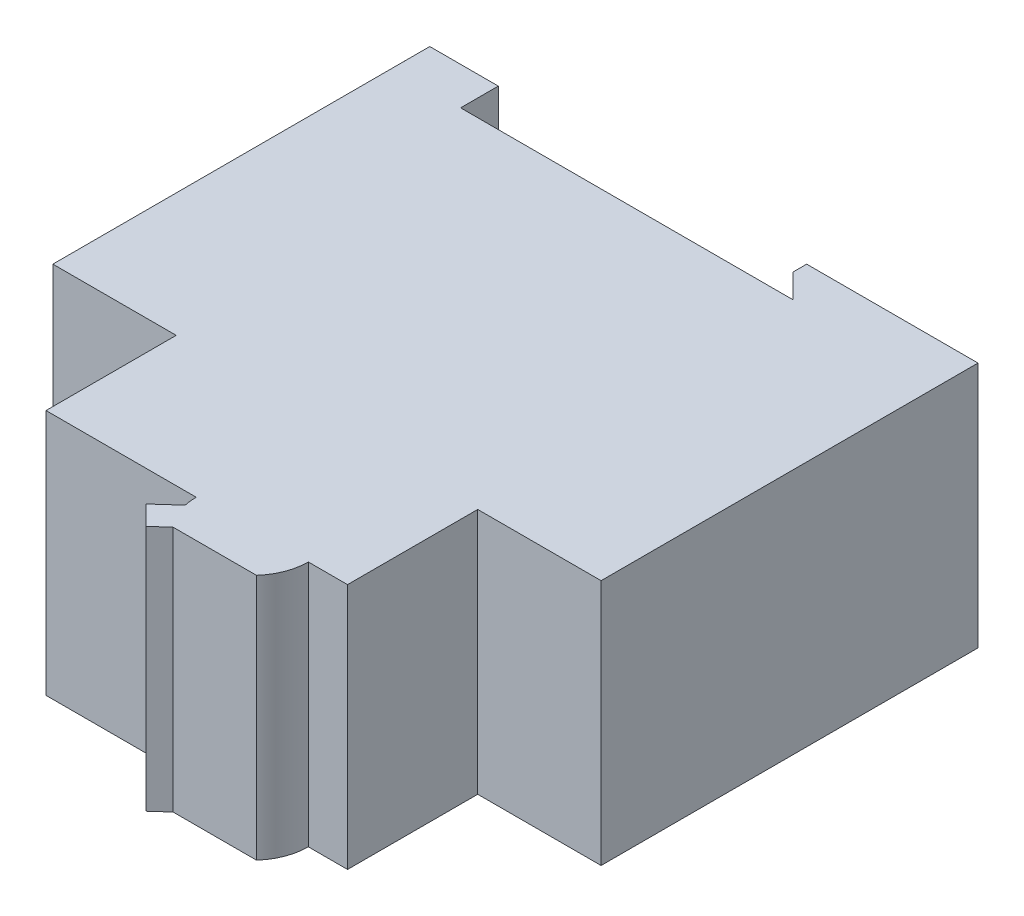
from build123d import *

# Parameters (mm, degrees)
SKETCH_6_W          = 80
SKETCH_6_H          = 31
EXTRUDE_1_DEPTH     = 85
SKETCH_8_W          = 18
SKETCH_8_H          = 30
CUT_EXTRUDE_1_DEPTH = 100
SKETCH_9_W          = 44
SKETCH_9_H          = 30
EXTRUDE_3_DEPTH     = 5
CUT_EXTRUDE_2_DEPTH = 110


with BuildPart() as part:
    # 草图6 → 凸台-拉伸1 (new body)
    with BuildSketch(Plane.XY):
        with Locations((40, -15.5)):
            Rectangle(SKETCH_6_W, SKETCH_6_H)
    extrude(amount=EXTRUDE_1_DEPTH)

    # 草图8 → 切除-拉伸1 (cut)
    with BuildSketch(Plane(origin=(0, 0, 0), x_dir=(1, 0, 0), z_dir=(0, 1, 0))):
        with Locations((71, -70)):
            Rectangle(SKETCH_8_W, SKETCH_8_H)
        with Locations((9, -70)):
            Rectangle(SKETCH_8_W, SKETCH_8_H)
    extrude(amount=-CUT_EXTRUDE_1_DEPTH, mode=Mode.SUBTRACT)

    # 草图9 → 凸台-拉伸3 (add)
    with BuildSketch(Plane(origin=(0, 0, 0), x_dir=(1, 0, 0), z_dir=(0, 1, 0))):
        Polygon((18, -55), (62, -55), (80, -55), (80, 0), (0, 0), (0, -55), align=None)
        with Locations((40, -70)):
            Rectangle(SKETCH_9_W, SKETCH_9_H)
    extrude(amount=EXTRUDE_3_DEPTH)

    # 草图10 → 切除-拉伸2 (cut)
    with BuildSketch(Plane.XZ.offset(31)):
        Polygon((10, 0), (55, 0), (55, 2), (58.5, 5.5), (10, 5.5), align=None)
        with BuildLine():
            Line((39.91937897, 81.354169844), (42.016320752, 79.468982831))
            Line((42.016320752, 79.468982831), (54.182900006, 79.468982831))
            ThreePointArc((54.182900006, 79.468982831), (55.737637047, 76.92860624), (56.279841788, 74))
            Line((56.279841788, 74), (62, 74))
            Line((62, 74), (62, 85))
            Line((62, 85), (18, 85))
            Line((18, 85), (18, 74))
            Line((18, 74), (39.91937897, 74))
            ThreePointArc((39.91937897, 74), (39.969784262, 74.906704585), (40.120378957, 75.802235229))
            Line((40.120378957, 75.802235229), (37.090951845, 78.52574272))
            Line((37.090951845, 78.52574272), (39.91937897, 81.354169844))
        make_face()
    extrude(amount=-CUT_EXTRUDE_2_DEPTH, mode=Mode.SUBTRACT)


solid = part.part
